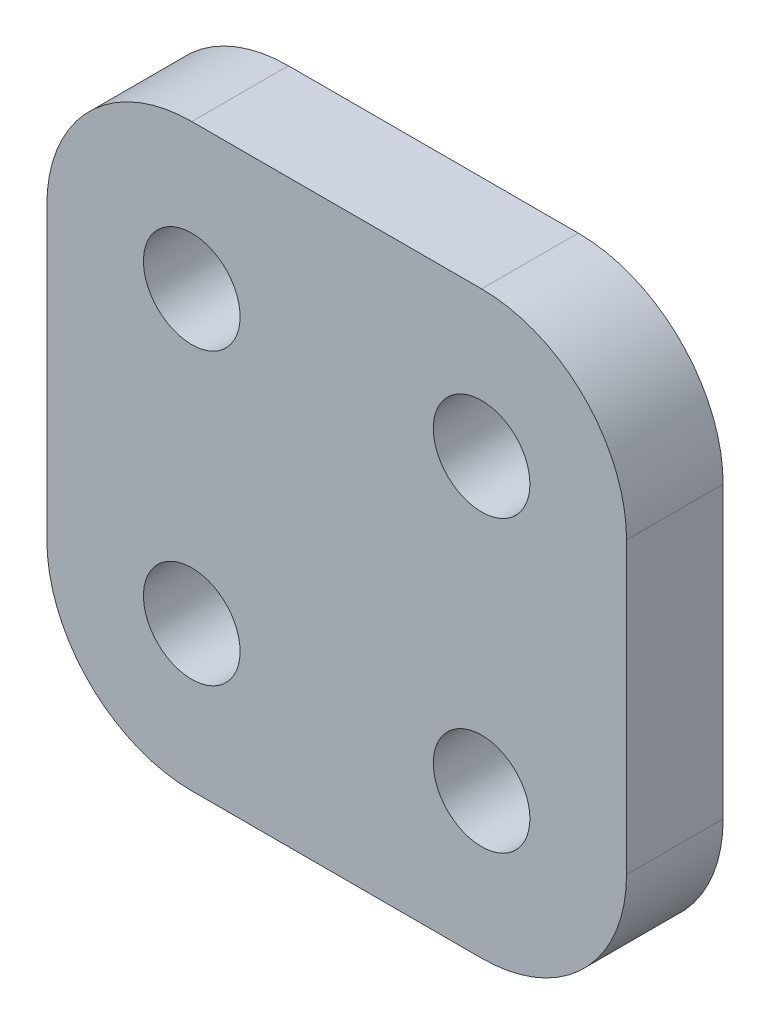
from build123d import *

# Parameters (mm, degrees)
MODEL_R                 = 1.5
SALIENTE_EXTRUIR1_DEPTH = 3


with BuildPart() as part:
    # Model → Saliente-Extruir1 (new body)
    with BuildSketch(Plane.XY):
        with BuildLine():
            Line((195.335922194, 161.333196305), (204.335922194, 161.333196305))
            ThreePointArc((204.335922194, 161.333196305), (207.517902709, 162.651215789), (208.835922194, 165.833196305))
            Line((208.835922194, 165.833196305), (208.835922194, 174.833196305))
            ThreePointArc((208.835922194, 174.833196305), (207.517902709, 178.01517682), (204.335922194, 179.333196305))
            Line((204.335922194, 179.333196305), (195.335922194, 179.333196305))
            ThreePointArc((195.335922194, 179.333196305), (192.153941678, 178.01517682), (190.835922194, 174.833196305))
            Line((190.835922194, 174.833196305), (190.835922194, 165.833196305))
            ThreePointArc((190.835922194, 165.833196305), (192.153941678, 162.651215789), (195.335922194, 161.333196305))
        make_face()
        with Locations((195.335922194, 174.833196305)):
            Circle(MODEL_R, mode=Mode.SUBTRACT)
        with Locations((195.335922194, 165.833196305)):
            Circle(MODEL_R, mode=Mode.SUBTRACT)
        with Locations((204.335922194, 174.833196305)):
            Circle(MODEL_R, mode=Mode.SUBTRACT)
        with Locations((204.335922194, 165.833196305)):
            Circle(MODEL_R, mode=Mode.SUBTRACT)
    extrude(amount=SALIENTE_EXTRUIR1_DEPTH)


solid = part.part
